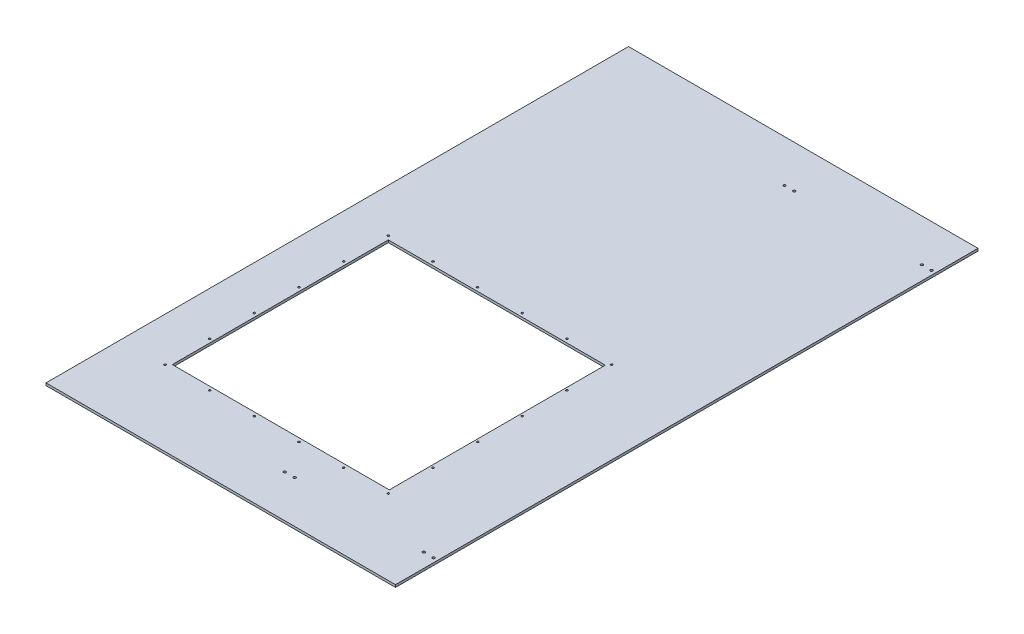
from build123d import *

# Parameters (mm, degrees)
SKETCH1_W           = 914.4
SKETCH1_H           = 1524
BOSS_EXTRUDE1_DEPTH = 6.35
SKETCH2_R           = 3.2639
CUT_EXTRUDE1_DEPTH  = 889.659756318
SKETCH3_W           = 567.7408
SKETCH3_H           = 565.15
SKETCH3_R           = 2.5908
CUT_EXTRUDE2_DEPTH  = 889.659756318


with BuildPart() as part:
    # Sketch1 → Boss-Extrude1 (new body)
    with BuildSketch(Plane(origin=(0, 0, 0), x_dir=(1, 0, 0), z_dir=(0, 1, 0))):
        Rectangle(SKETCH1_W, SKETCH1_H)
    extrude(amount=BOSS_EXTRUDE1_DEPTH)

    # Sketch2 → Cut-Extrude1 (cut, through all)
    with BuildSketch(Plane.XZ):
        with Locations((56.9595, 651.2814)):
            Circle(SKETCH2_R)
        with Locations((82.3595, 651.2814)):
            Circle(SKETCH2_R)
        with Locations((446.0875, 651.2814)):
            Circle(SKETCH2_R)
        with Locations((420.6875, 651.2814)):
            Circle(SKETCH2_R)
        with Locations((61.722, -651.2814)):
            Circle(SKETCH2_R)
        with Locations((87.122, -651.2814)):
            Circle(SKETCH2_R)
        with Locations((420.878, -651.2814)):
            Circle(SKETCH2_R)
        with Locations((446.278, -651.2814)):
            Circle(SKETCH2_R)
    extrude(amount=-CUT_EXTRUDE1_DEPTH, mode=Mode.SUBTRACT)

    # Sketch3 → Cut-Extrude2 (cut, through all)
    with BuildSketch(Plane(origin=(0, 6.35, 0), x_dir=(1, 0, 0), z_dir=(0, 1, 0))):
        with Locations((-49.5046, -272.796)):
            Rectangle(SKETCH3_W, SKETCH3_H)
        with Locations((241.3, 19.304)):
            Circle(SKETCH3_R)
        with Locations((241.3, -97.536)):
            Circle(SKETCH3_R)
        with Locations((241.3, -214.376)):
            Circle(SKETCH3_R)
        with Locations((241.3, -331.216)):
            Circle(SKETCH3_R)
        with Locations((241.3, -448.056)):
            Circle(SKETCH3_R)
        with Locations((241.3, -564.896)):
            Circle(SKETCH3_R)
        with Locations((-342.9, -564.896)):
            Circle(SKETCH3_R)
        with Locations((-226.06, -564.896)):
            Circle(SKETCH3_R)
        with Locations((-109.22, -564.896)):
            Circle(SKETCH3_R)
        with Locations((7.62, -564.896)):
            Circle(SKETCH3_R)
        with Locations((124.46, -564.896)):
            Circle(SKETCH3_R)
        with Locations((-342.9, -448.056)):
            Circle(SKETCH3_R)
        with Locations((-342.9, -331.216)):
            Circle(SKETCH3_R)
        with Locations((-342.9, -214.376)):
            Circle(SKETCH3_R)
        with Locations((-342.9, -97.536)):
            Circle(SKETCH3_R)
        with Locations((124.46, 19.304)):
            Circle(SKETCH3_R)
        with Locations((7.62, 19.304)):
            Circle(SKETCH3_R)
        with Locations((-109.22, 19.304)):
            Circle(SKETCH3_R)
        with Locations((-226.06, 19.304)):
            Circle(SKETCH3_R)
        with Locations((-342.9, 19.304)):
            Circle(SKETCH3_R)
    extrude(amount=-CUT_EXTRUDE2_DEPTH, mode=Mode.SUBTRACT)


solid = part.part
